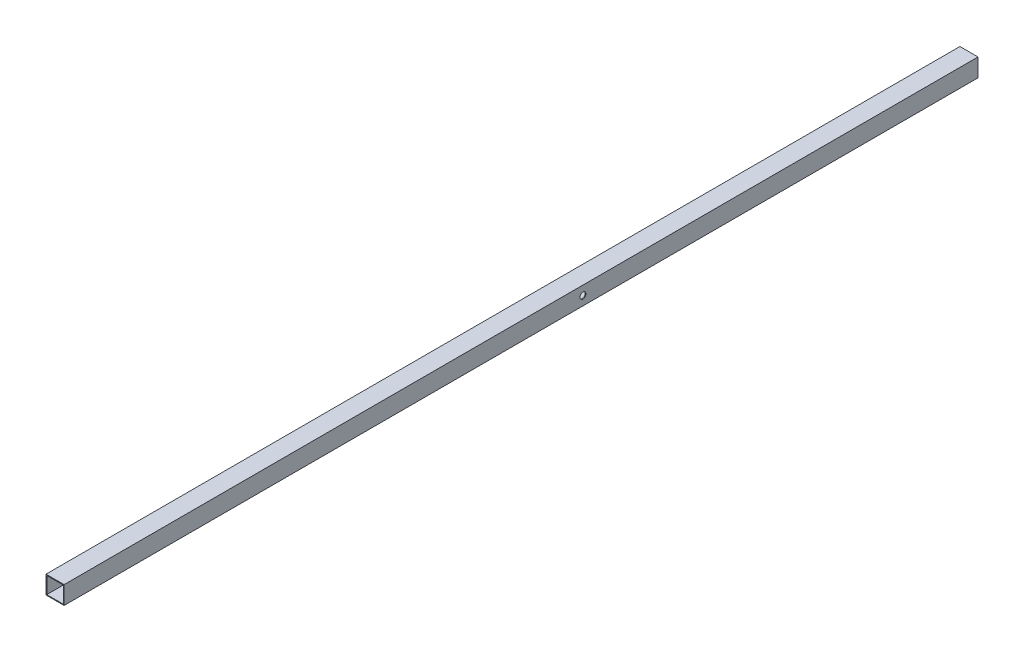
from build123d import *

# Parameters (mm, degrees)
SKETCH2_W                  = 38.1
SKETCH2_H                  = 38.1
SKETCH2_W_2                = 34.925
SKETCH2_H_2                = 34.925
BOSS_EXTRUDE1_DEPTH        = 1924.05
F_1_2_0_5_DIAMETER_HOLE1_D = 12.7


with BuildPart() as part:
    # Sketch2 → Boss-Extrude1 (new body)
    with BuildSketch(Plane.XY):
        with Locations((19.05, 19.05)):
            Rectangle(SKETCH2_W, SKETCH2_H)
        with Locations((19.05, 19.05)):
            Rectangle(SKETCH2_W_2, SKETCH2_H_2, mode=Mode.SUBTRACT)
    extrude(amount=BOSS_EXTRUDE1_DEPTH)

    # 1/2 (0.5) Diameter Hole1 (through all)
    with Locations(Plane.ZY):
        with Locations((831.85, 19.05)):
            Hole(F_1_2_0_5_DIAMETER_HOLE1_D / 2)


solid = part.part
